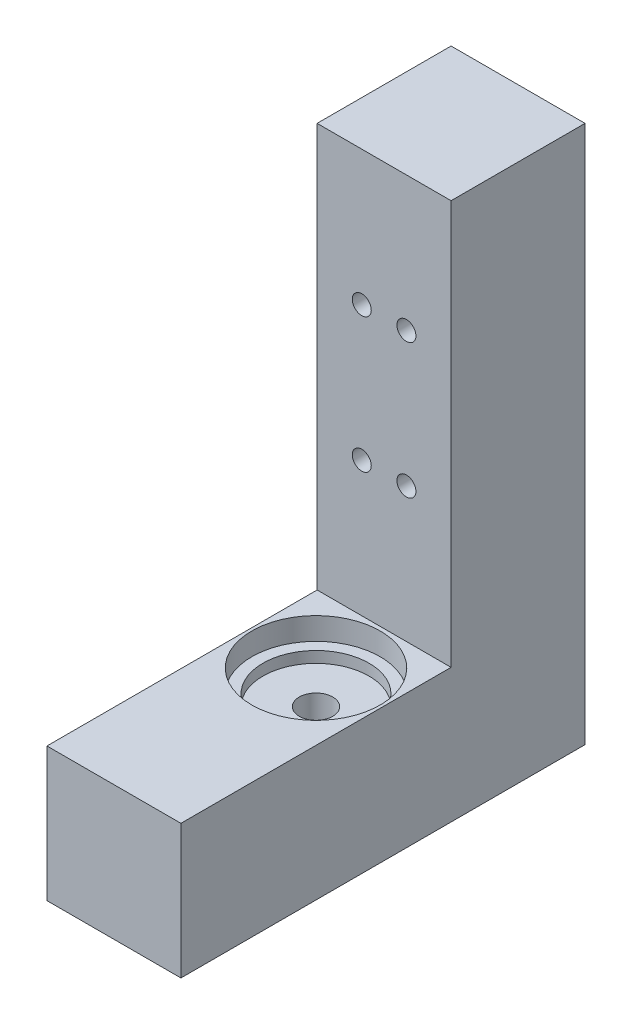
from build123d import *

# Parameters (mm, degrees)
SKETCH2_W            = 72.4
SKETCH2_H            = 24
BOSS_EXTRUDE3_DEPTH  = 24
SKETCH5_W            = 24
SKETCH5_H            = 24
BOSS_EXTRUDE4_DEPTH  = 72.4
SKETCH6_R            = 1.7
CUT_EXTRUDE2_DEPTH   = 111.505746457
LPATTERN1_COUNT      = 2
LPATTERN1_PITCH      = 8
LPATTERN1_COUNT_DIR2 = 2
LPATTERN1_PITCH_DIR2 = 24.13
SKETCH7_R            = 11.5
CUT_EXTRUDE3_DEPTH   = 4
SKETCH8_R            = 9.5
CUT_EXTRUDE4_DEPTH   = 2
SKETCH9_R            = 3
CUT_EXTRUDE5_DEPTH   = 7


with BuildPart() as part:
    # Sketch2 → Boss-Extrude3 (new body)
    with BuildSketch(Plane(origin=(0, 0, 0), x_dir=(0, 0, -1), z_dir=(1, 0, 0))):
        with Locations((-36.2, 12)):
            Rectangle(SKETCH2_W, SKETCH2_H)
    extrude(amount=BOSS_EXTRUDE3_DEPTH)

    # Sketch5 → Boss-Extrude4 (add)
    with BuildSketch(Plane(origin=(0, 24, 0), x_dir=(1, 0, 0), z_dir=(0, 1, 0))):
        with Locations((12, -12)):
            Rectangle(SKETCH5_W, SKETCH5_H)
    extrude(amount=BOSS_EXTRUDE4_DEPTH)

    # Sketch6 → Cut-Extrude2 (cut, symmetric)
    with BuildSketch(Plane.XY.offset(24)):
        with Locations((8, 72.266666667)):
            Circle(SKETCH6_R)
    cut_extrude2 = extrude(amount=CUT_EXTRUDE2_DEPTH, both=True, mode=Mode.SUBTRACT)

    # LPattern1: Cut-Extrude2 2 × 2
    with Locations(*[(i * LPATTERN1_PITCH, -j * LPATTERN1_PITCH_DIR2, 0) for i in range(LPATTERN1_COUNT) for j in range(LPATTERN1_COUNT_DIR2) if (i, j) != (0, 0)]):
        add(cut_extrude2, mode=Mode.SUBTRACT)

    # Sketch7 → Cut-Extrude3 (cut)
    with BuildSketch(Plane(origin=(0, 24, 0), x_dir=(1, 0, 0), z_dir=(0, 1, 0))):
        with Locations(Location((12, -36.2, 0), (0, 0, 270))):
            Circle(SKETCH7_R)
    extrude(amount=-CUT_EXTRUDE3_DEPTH, mode=Mode.SUBTRACT)

    # Sketch8 → Cut-Extrude4 (cut)
    with BuildSketch(Plane(origin=(0, 20, 0), x_dir=(1, 0, 0), z_dir=(0, 1, 0))):
        with Locations(Location((12, -36.2, 0), (0, 0, 270))):
            Circle(SKETCH8_R)
    extrude(amount=-CUT_EXTRUDE4_DEPTH, mode=Mode.SUBTRACT)

    # Sketch9 → Cut-Extrude5 (cut)
    with BuildSketch(Plane(origin=(0, 18, 0), x_dir=(1, 0, 0), z_dir=(0, 1, 0))):
        with Locations(Location((12, -36.2, 0), (0, 0, 270))):
            Circle(SKETCH9_R)
    extrude(amount=-CUT_EXTRUDE5_DEPTH, mode=Mode.SUBTRACT)


solid = part.part
